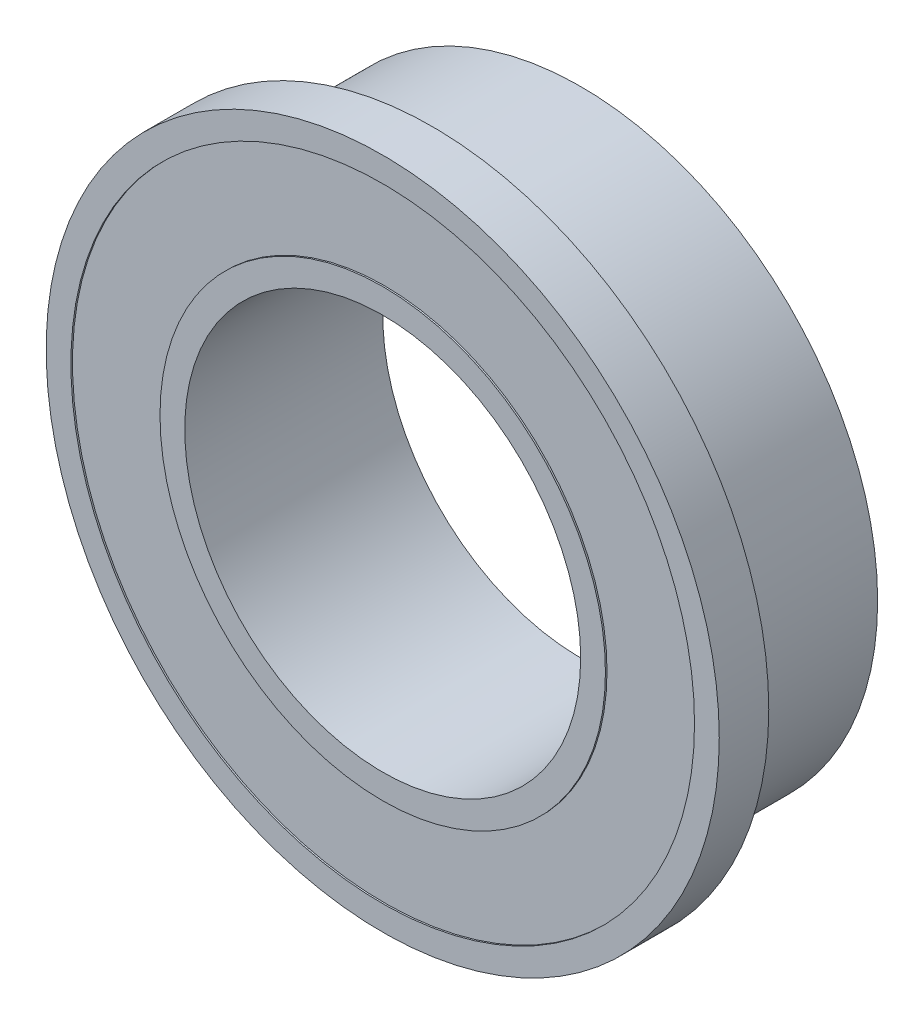
from build123d import *

# Parameters (mm, degrees)
SKETCH1_R           = 4.7625
SKETCH1_R_2         = 3.175
BOSS_EXTRUDE1_DEPTH = 3.175
BOSS_EXTRUDE2_START = -0.79375
SKETCH2_R           = 5.3975
SKETCH2_R_2         = 4.7625
BOSS_EXTRUDE2_DEPTH = 0.79375
SKETCH3_R           = 5.000625
SKETCH3_R_2         = 3.571875
CUT_EXTRUDE1_DEPTH  = 0.0254
CUT_EXTRUDE2_START  = -0.0254
SKETCH4_R           = 4.365625
SKETCH4_R_2         = 3.571875
CUT_EXTRUDE2_DEPTH  = 0.0254


with BuildPart() as part:
    # Sketch1 → Boss-Extrude1 (new body)
    with BuildSketch(Plane.XY):
        Circle(SKETCH1_R)
        Circle(SKETCH1_R_2, mode=Mode.SUBTRACT)
    extrude(amount=BOSS_EXTRUDE1_DEPTH)

    # Sketch2 → Boss-Extrude2 (add)
    with BuildSketch(Plane.XY.offset(3.175).offset(BOSS_EXTRUDE2_START)):
        Circle(SKETCH2_R)
        Circle(SKETCH2_R_2, mode=Mode.SUBTRACT)
    extrude(amount=BOSS_EXTRUDE2_DEPTH)

    # Sketch3 → Cut-Extrude1 (cut)
    with BuildSketch(Plane.XY.offset(3.175)):
        Circle(SKETCH3_R)
        Circle(SKETCH3_R_2, mode=Mode.SUBTRACT)
    extrude(amount=-CUT_EXTRUDE1_DEPTH, mode=Mode.SUBTRACT)

    # Sketch4 → Cut-Extrude2 (cut)
    with BuildSketch(Plane(origin=(0, 0, 0), x_dir=(-1, 0, 0), z_dir=(0, 0, -1)).offset(CUT_EXTRUDE2_START)):
        Circle(SKETCH4_R)
        with Locations(Location((0, 0, 0), (0, 0, 180))):
            Circle(SKETCH4_R_2, mode=Mode.SUBTRACT)
    extrude(amount=CUT_EXTRUDE2_DEPTH, mode=Mode.SUBTRACT)


solid = part.part
